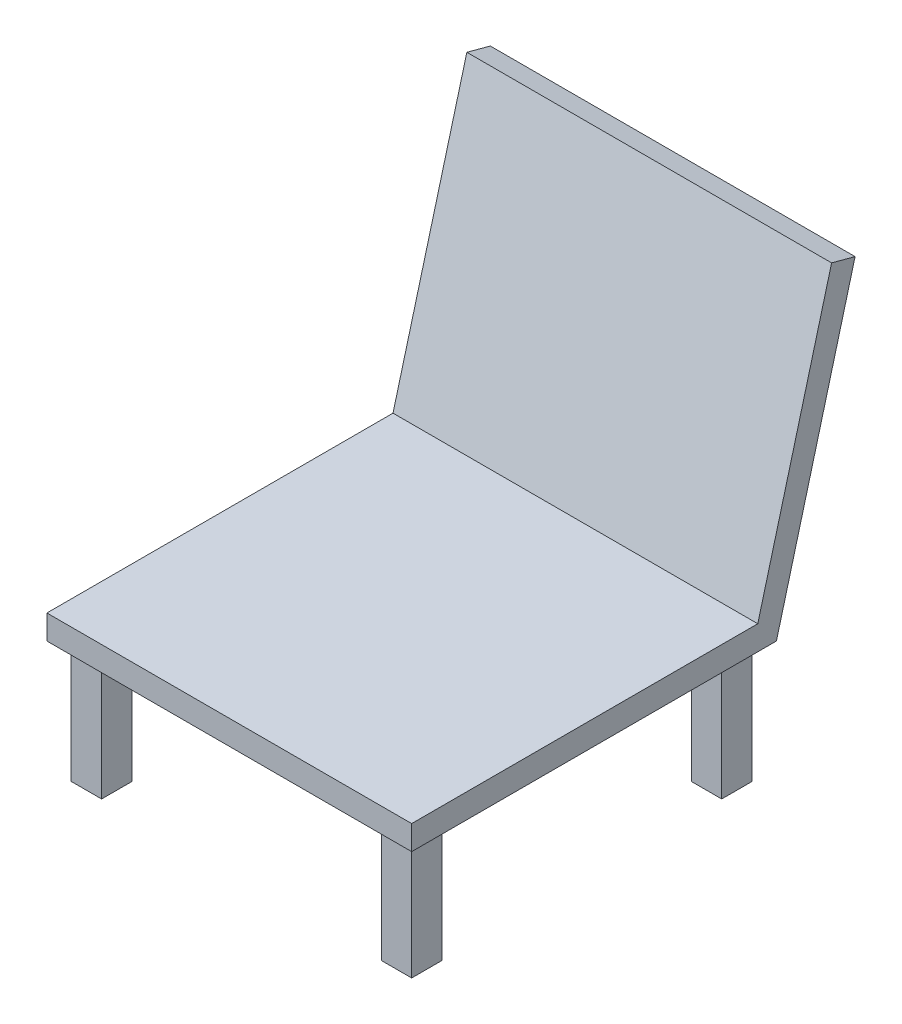
from build123d import *

# Parameters (mm, degrees)
BOSS_EXTRUDE1_DEPTH = 300
SKETCH6_W           = 25
SKETCH6_H           = 25
BOSS_EXTRUDE2_DEPTH = 100


with BuildPart() as part:
    # Sketch3 → Boss-Extrude1 (new body)
    with BuildSketch(Plane(origin=(0, 0, 0), x_dir=(0, 0, -1), z_dir=(1, 0, 0))):
        Polygon((-476.395417156, 336.925610034), (-411.69065588, 578.407066606), (-431.009172406, 583.583447508), (-491.741956916, 356.925610034), (-776.395417156, 356.925610034), (-776.395417156, 336.925610034), align=None)
    extrude(amount=BOSS_EXTRUDE1_DEPTH)

    # Sketch6 → Boss-Extrude2 (add)
    with BuildSketch(Plane.XZ.offset(-336.925610034)):
        with Locations((277.5, 753.895417156)):
            Rectangle(SKETCH6_W, SKETCH6_H)
        with Locations((22.5, 753.895417156)):
            Rectangle(SKETCH6_W, SKETCH6_H)
        with Locations((277.5, 498.895417156)):
            Rectangle(SKETCH6_W, SKETCH6_H)
        with Locations((22.5, 498.895417156)):
            Rectangle(SKETCH6_W, SKETCH6_H)
    extrude(amount=BOSS_EXTRUDE2_DEPTH)


solid = part.part
